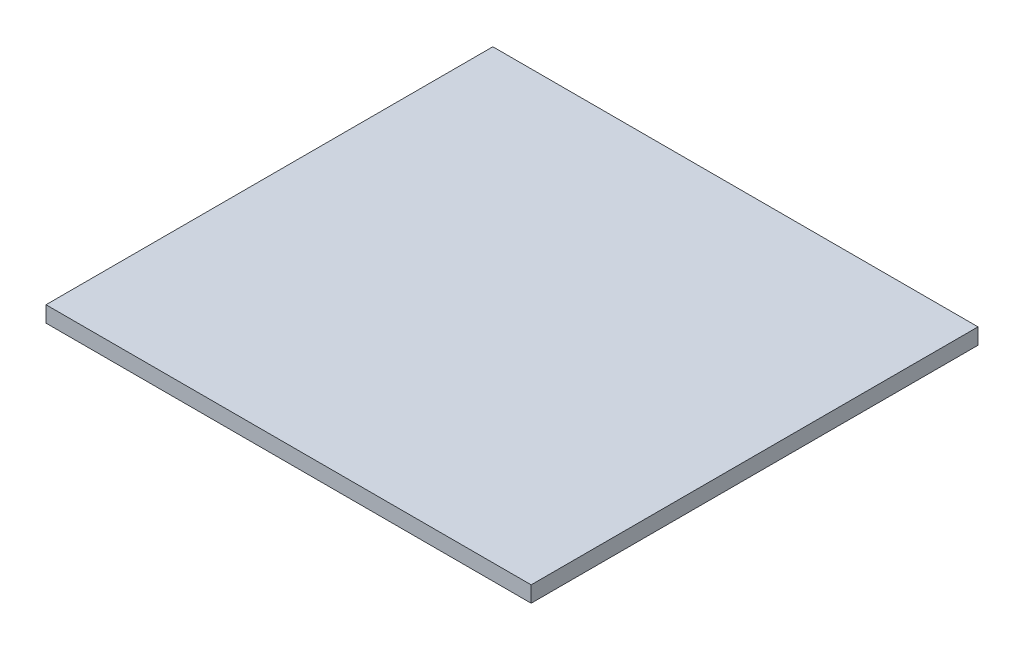
from build123d import *

# Parameters (mm, degrees)
SKETCH1_W           = 96.52
SKETCH1_H           = 88.9
BOSS_EXTRUDE1_DEPTH = 3.175


with BuildPart() as part:
    # Sketch1 → Boss-Extrude1 (new body)
    with BuildSketch(Plane(origin=(0, 0, 0), x_dir=(1, 0, 0), z_dir=(0, 1, 0))):
        with Locations((48.26, 44.45)):
            Rectangle(SKETCH1_W, SKETCH1_H)
    extrude(amount=BOSS_EXTRUDE1_DEPTH)


solid = part.part
